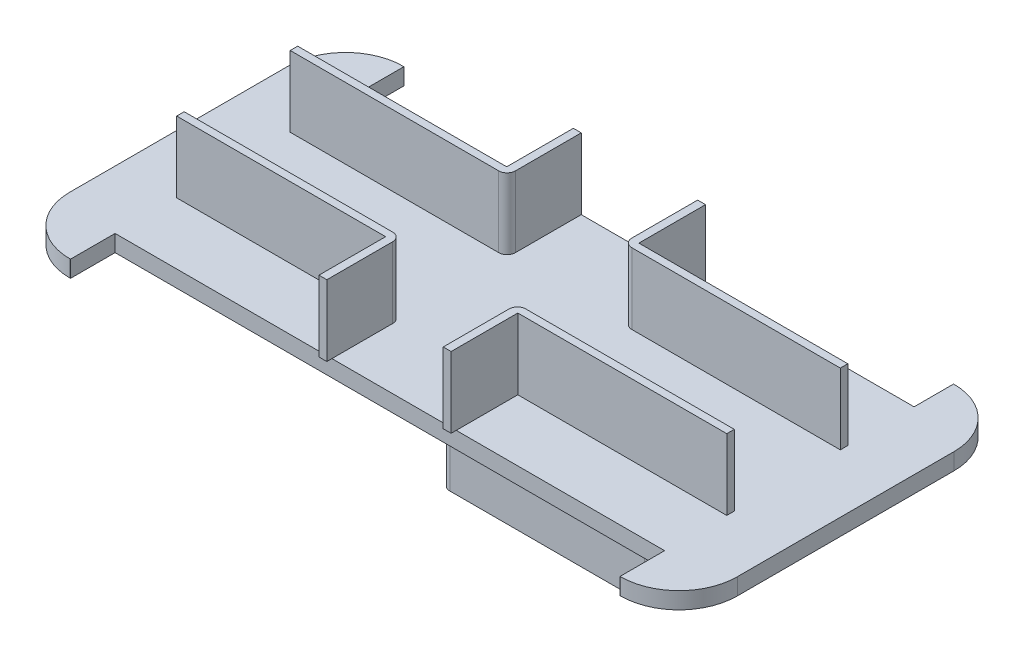
from build123d import *

# Parameters (mm, degrees)
SKETCH1_W            = 203.2
SKETCH1_H            = 101.6
BOSS_EXTRUDE1_DEPTH  = 5.08
SKETCH2_W            = 167.467297736
SKETCH2_H            = 13.584196144
CUT_EXTRUDE4_DEPTH   = 114.705788771
BOSS_EXTRUDE2_DEPTH  = 21.59
FILLET1_R            = 2.54
FILLET2_R            = 2.54
MIRROR3_COPY_1_DEPTH = 21.59
FILLET3_R            = 2.54
SKETCH5_W            = 64.377921573
SKETCH5_H            = 57.58977338
BOSS_EXTRUDE4_DEPTH  = 20.32
SKETCH6_W            = 59.998471125
SKETCH6_H            = 52.334432844
CUT_EXTRUDE5_DEPTH   = 20.32
SKETCH7_W            = 37.334815061
SKETCH7_H            = 5.20069898
CUT_EXTRUDE6_DEPTH   = 124.024580753
SKETCH8_W            = 45.765257173
SKETCH8_H            = 5.912359678
CUT_EXTRUDE7_DEPTH   = 132.792241377
FILLET4_R            = 2.54


with BuildPart() as part:
    # Sketch1 → Boss-Extrude1 (new body)
    with BuildSketch(Plane(origin=(0, 0, 0), x_dir=(1, 0, 0), z_dir=(0, 1, 0))):
        Rectangle(SKETCH1_W, SKETCH1_H)
    extrude(amount=BOSS_EXTRUDE1_DEPTH)

    # Sketch2 → Cut-Extrude4 (cut, through all)
    with BuildSketch(Plane(origin=(0, 5.08, 0), x_dir=(1, 0, 0), z_dir=(0, 1, 0))):
        Polygon((83.693773799, 50.8), (-83.82, 50.8), (-83.82, 50.443396551), (-83.82, 38.767661401), (83.693773799, 38.767661401), (83.693773799, 50.443396551), align=None)
        with BuildLine():
            Line((101.6, 50.8), (83.82, 50.8))
            ThreePointArc((83.82, 50.8), (96.392358569, 45.592358569), (101.6, 33.02))
            Line((101.6, 33.02), (101.6, 50.8))
        make_face()
        with BuildLine():
            Line((101.6, -50.8), (101.6, -33.02))
            ThreePointArc((101.6, -33.02), (96.392358569, -45.592358569), (83.82, -50.8))
            Line((83.82, -50.8), (101.6, -50.8))
        make_face()
        with BuildLine():
            ThreePointArc((-84.074, -50.8), (-96.466753447, -45.666753447), (-101.6, -33.274))
            Line((-101.6, -33.274), (-101.6, -50.8))
            Line((-101.6, -50.8), (-84.074, -50.8))
        make_face()
        with BuildLine():
            ThreePointArc((-101.6, 33.274), (-96.466753447, 45.666753447), (-84.074, 50.8))
            Line((-84.074, 50.8), (-101.6, 50.8))
            Line((-101.6, 50.8), (-101.6, 33.274))
        make_face()
        with Locations((-0.086351132, -44.007901928)):
            Rectangle(SKETCH2_W, SKETCH2_H)
    extrude(amount=-CUT_EXTRUDE4_DEPTH, mode=Mode.SUBTRACT)

    # Sketch4 → Boss-Extrude2 (add)
    with BuildSketch(Plane(origin=(0, 5.08, 0), x_dir=(1, 0, 0), z_dir=(0, 1, 0))):
        Polygon((-83.82, 16.161661401), (-17.736774311, 16.161661401), (-17.736774311, 38.767661401), (-20.145472057, 38.767661401), (-20.145472057, 18.447661401), (-83.82, 18.447661401), align=None)
    boss_extrude2 = extrude(amount=BOSS_EXTRUDE2_DEPTH)

    # Fillet1
    fillet1_edges = [part.edges().sort_by_distance(p)[0] for p in [
        (-17.736774311, 15.875, -16.161661401),
    ]]
    fillet(fillet1_edges, radius=FILLET1_R)

    # Mirror1: Boss-Extrude2 across plane
    add(boss_extrude2.mirror(Plane(origin=(0, 0, 0), x_dir=(0, 0, 1), z_dir=(1, 0, 0))))

    # Fillet2
    fillet2_edges = [part.edges().sort_by_distance(p)[0] for p in [
        (17.736774311, 15.875, -16.161661401),
    ]]
    fillet(fillet2_edges, radius=FILLET2_R)

    # Mirror3: Boss-Extrude2 across plane
    add(boss_extrude2.mirror(Plane.XY))

    # Mirror3 copy 1 sketch → Mirror3 copy 1 (add)
    with BuildSketch(Plane(origin=(0, 5.08, 0), x_dir=(-1, 0, 0), z_dir=(0, 1, 0))):
        Polygon((-83.82, 16.161661401), (-17.736774311, 16.161661401), (-17.736774311, 38.767661401), (-20.145472057, 38.767661401), (-20.145472057, 18.447661401), (-83.82, 18.447661401), align=None)
    extrude(amount=MIRROR3_COPY_1_DEPTH)

    # Fillet3
    fillet3_edges = [part.edges().sort_by_distance(p)[0] for p in [
        (-17.736774311, 15.875, 16.161661401),
        (17.736774311, 15.875, 16.161661401),
    ]]
    fillet(fillet3_edges, radius=FILLET3_R)

    # Sketch5 → Boss-Extrude4 (add)
    with BuildSketch(Plane.XZ):
        with Locations((39.415054025, 0)):
            Rectangle(SKETCH5_W, SKETCH5_H)
    extrude(amount=BOSS_EXTRUDE4_DEPTH)

    # Sketch6 → Cut-Extrude5 (cut)
    with BuildSketch(Plane.XZ.offset(20.32)):
        with Locations((39.634026547, 0)):
            Rectangle(SKETCH6_W, SKETCH6_H)
    extrude(amount=-CUT_EXTRUDE5_DEPTH, mode=Mode.SUBTRACT)

    # Sketch7 → Cut-Extrude6 (cut, through all)
    with BuildSketch(Plane.ZY.offset(-7.226093238)):
        with Locations((0.602174437, -2.60034949)):
            Rectangle(SKETCH7_W, SKETCH7_H)
    extrude(amount=-CUT_EXTRUDE6_DEPTH, mode=Mode.SUBTRACT)

    # Sketch8 → Cut-Extrude7 (cut, through all)
    with BuildSketch(Plane(origin=(0, 0, -28.79488669), x_dir=(-1, 0, 0), z_dir=(0, 0, -1))):
        with Locations((-39.524540286, -2.956179839)):
            Rectangle(SKETCH8_W, SKETCH8_H)
    extrude(amount=-CUT_EXTRUDE7_DEPTH, mode=Mode.SUBTRACT)

    # Fillet4
    fillet4_edges = [part.edges().sort_by_distance(p)[0] for p in [
        (7.226093238, -10.16, 28.79488669),
        (7.226093238, -10.16, -28.79488669),
        (71.604014811, -10.16, -28.79488669),
        (71.604014811, -10.16, 28.79488669),
    ]]
    fillet(fillet4_edges, radius=FILLET4_R)


solid = part.part
